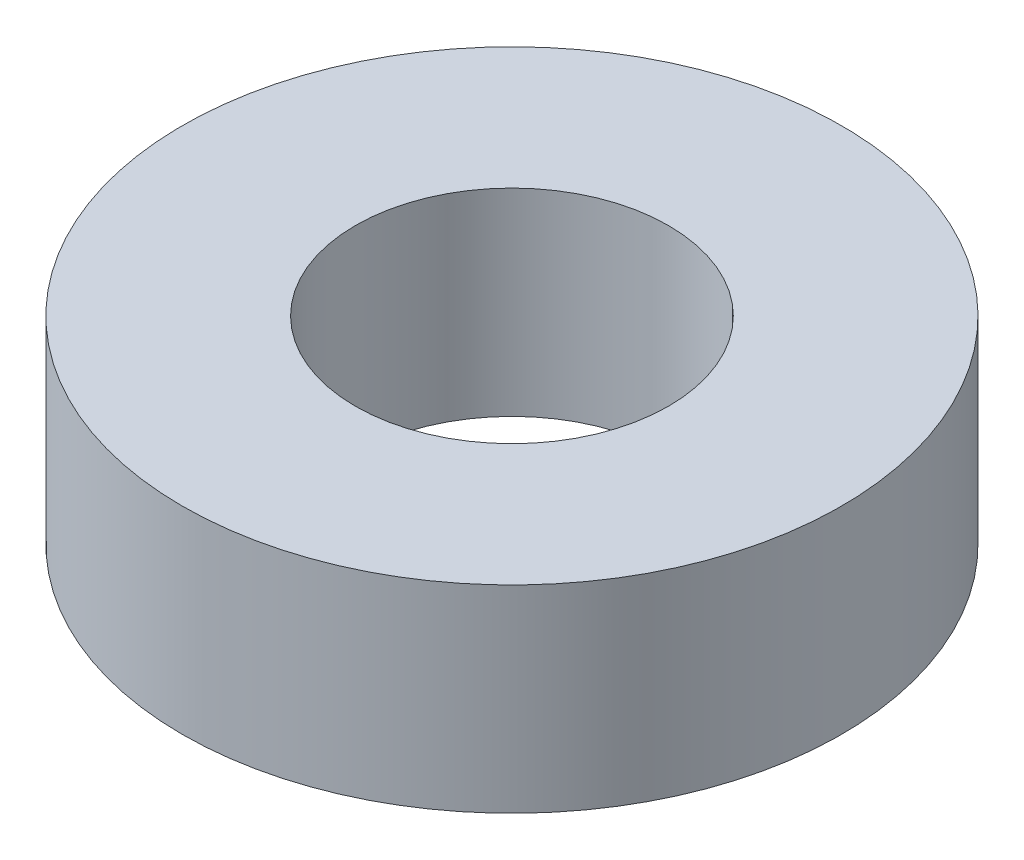
from build123d import *

# Parameters (mm, degrees)
SKETCH_1_R      = 5
SKETCH_1_R_2    = 2.375
EXTRUDE_1_DEPTH = 3


with BuildPart() as part:
    # 草图1 → 凸台-拉伸1 (new body)
    with BuildSketch(Plane(origin=(0, 0, 0), x_dir=(1, 0, 0), z_dir=(0, 1, 0))):
        with Locations(Location((0, 0, 0), (0, 0, 270))):
            Circle(SKETCH_1_R)
        with Locations(Location((0, 0, 0), (0, 0, 270))):
            Circle(SKETCH_1_R_2, mode=Mode.SUBTRACT)
    extrude(amount=EXTRUDE_1_DEPTH)


solid = part.part
